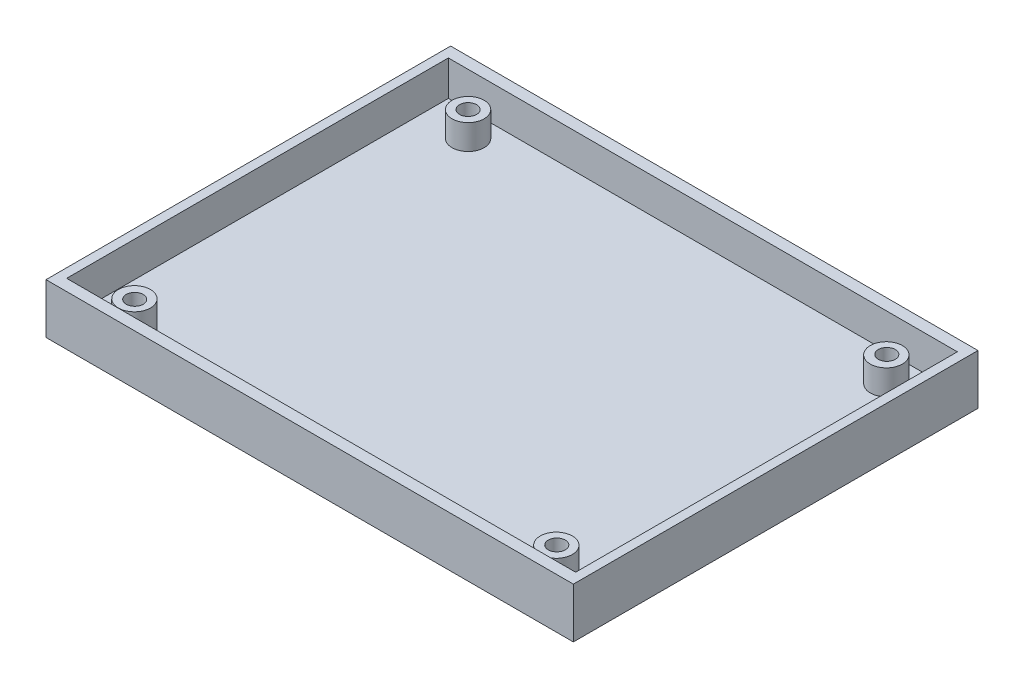
from build123d import *

# Parameters (mm, degrees)
SKETCH1_W           = 101.6
SKETCH1_H           = 76.2
SKETCH1_R           = 3.201261119
BOSS_EXTRUDE4_DEPTH = 3
SKETCH1_8_W         = 105.264465986
SKETCH1_8_H         = 80.768961322
SKETCH1_8_W_2       = 101.6
SKETCH1_8_H_2       = 76.2
BOSS_EXTRUDE6_DEPTH = 10
SKETCH1_10_R        = 3.201261119
SKETCH1_10_R_2      = 1.7
BOSS_EXTRUDE7_DEPTH = 8


with BuildPart() as part:
    # Sketch1 → Boss-Extrude4 (new body)
    with BuildSketch(Plane(origin=(0, 0, 0), x_dir=(1, 0, 0), z_dir=(0, 1, 0))):
        Rectangle(SKETCH1_W, SKETCH1_H)
        with Locations((-42.51175292, -32.859842277)):
            Circle(SKETCH1_R, mode=Mode.SUBTRACT)
        with Locations((42.20618594, -33.358721943)):
            Circle(SKETCH1_R, mode=Mode.SUBTRACT)
        with Locations((-41.91, 33.147)):
            Circle(SKETCH1_R, mode=Mode.SUBTRACT)
        with Locations((42.225895984, 32.494174618)):
            Circle(SKETCH1_R, mode=Mode.SUBTRACT)
    extrude(amount=BOSS_EXTRUDE4_DEPTH)

    # Sketch1<8> → Boss-Extrude6 (add)
    with BuildSketch(Plane(origin=(0, 0, 0), x_dir=(1, 0, 0), z_dir=(0, 1, 0))):
        Rectangle(SKETCH1_8_W, SKETCH1_8_H)
        Rectangle(SKETCH1_8_W_2, SKETCH1_8_H_2, mode=Mode.SUBTRACT)
    extrude(amount=BOSS_EXTRUDE6_DEPTH)

    # Sketch1<10> → Boss-Extrude7 (add)
    # profile 1 of 4: a face of its own
    with BuildSketch(Plane(origin=(0, 0, 0), x_dir=(1, 0, 0), z_dir=(0, 1, 0))):
        with Locations((-41.91, 33.147)):
            Circle(SKETCH1_10_R)
        with Locations((-41.91, 33.147)):
            Circle(SKETCH1_10_R_2, mode=Mode.SUBTRACT)
    # profile 2 of 4: a face of its own
    with BuildSketch(Plane(origin=(0, 0, 0), x_dir=(1, 0, 0), z_dir=(0, 1, 0))):
        with Locations((42.225895984, 32.494174618)):
            Circle(SKETCH1_10_R)
        with Locations((42.205092494, 32.605502829)):
            Circle(SKETCH1_10_R_2, mode=Mode.SUBTRACT)
    # profile 3 of 4: a face of its own
    with BuildSketch(Plane(origin=(0, 0, 0), x_dir=(1, 0, 0), z_dir=(0, 1, 0))):
        with Locations((-42.51175292, -32.859842277)):
            Circle(SKETCH1_10_R)
        with Locations((-42.370602661, -32.936523162)):
            Circle(SKETCH1_10_R_2, mode=Mode.SUBTRACT)
    # profile 4 of 4: a face of its own
    with BuildSketch(Plane(origin=(0, 0, 0), x_dir=(1, 0, 0), z_dir=(0, 1, 0))):
        with Locations((42.20618594, -33.358721943)):
            Circle(SKETCH1_10_R)
        with Locations((42.205092494, -33.267543495)):
            Circle(SKETCH1_10_R_2, mode=Mode.SUBTRACT)
    extrude(amount=BOSS_EXTRUDE7_DEPTH)


solid = part.part
